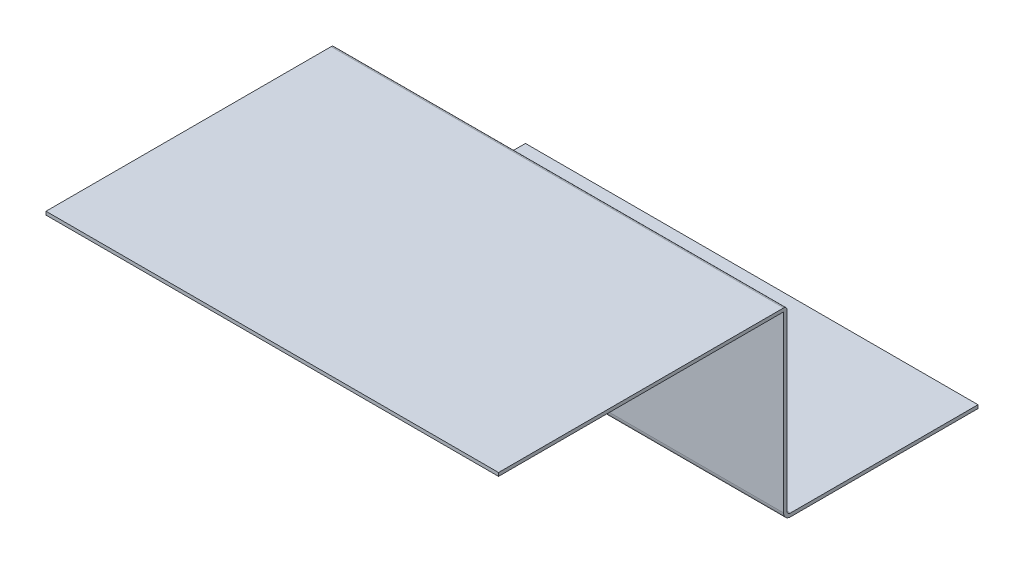
from build123d import *

# Parameters (mm, degrees)
SALIENTE_EXTRUIR1_DEPTH = 400


with BuildPart() as part:
    # Croquis1 → Saliente-Extruir1 (new body)
    with BuildSketch(Plane(origin=(0, 0, 0), x_dir=(0, 0, -1), z_dir=(1, 0, 0))):
        with BuildLine():
            Line((-3, 0), (-255, 0))
            Line((-255, 0), (-255, -3))
            Line((-255, -3), (-3, -3))
            Line((-3, -3), (-3, -157))
            ThreePointArc((-3, -157), (-1.242640687, -161.242640687), (3, -163))
            Line((3, -163), (168.8, -163))
            Line((168.8, -163), (168.8, -160))
            Line((168.8, -160), (3, -160))
            ThreePointArc((3, -160), (0.878679656, -159.121320344), (0, -157))
            Line((0, -157), (0, -3))
            ThreePointArc((0, -3), (-0.878679656, -0.878679656), (-3, 0))
        make_face()
    extrude(amount=SALIENTE_EXTRUIR1_DEPTH)


solid = part.part
